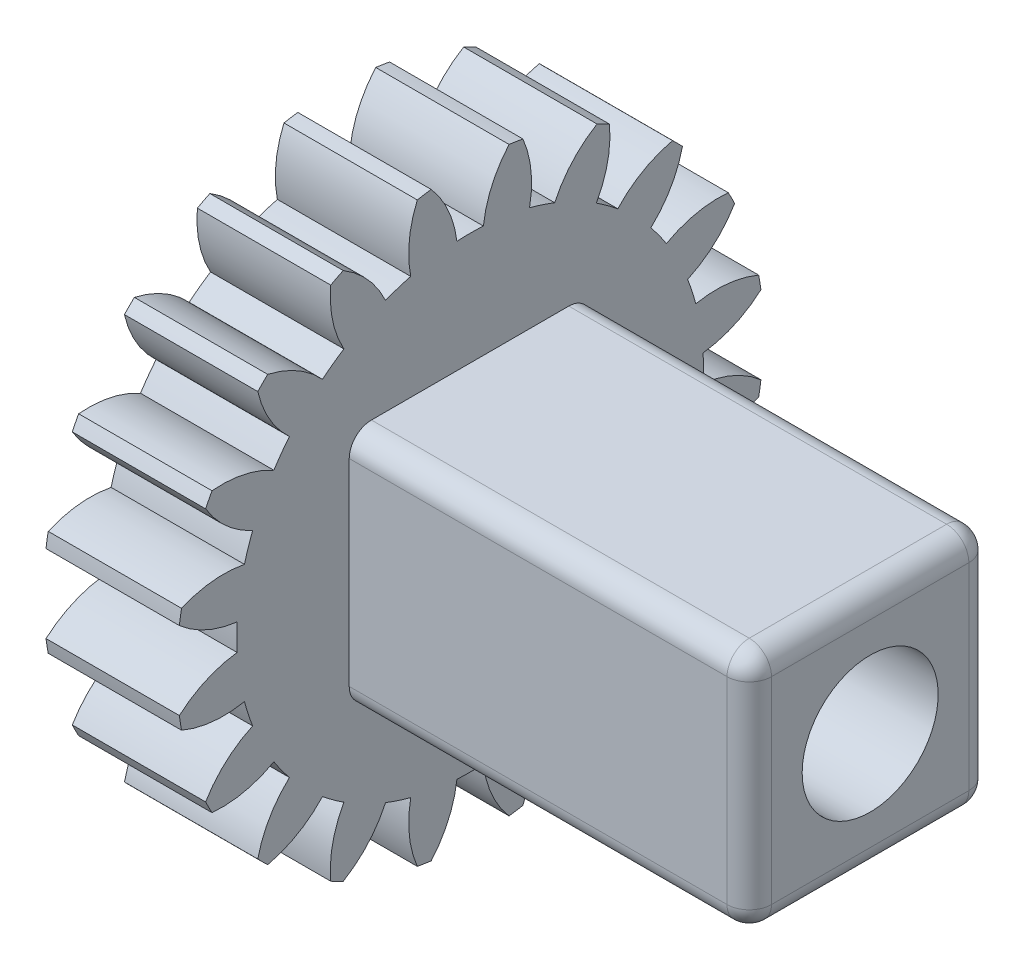
from build123d import *

# Parameters (mm, degrees)
BASPROSKE_W         = 15
BASPROSKE_H         = 33
TOOTHCUT_DEPTH      = 50.020403915
TEETHCUTS_COUNT     = 20
TEETHCUTS_ANGLE     = 342
BORSKE_R            = 2
BORE_DEPTH          = 50.0000508
SKETCH1_W           = 27.2
SKETCH1_H           = 27.2
BOSS_EXTRUDE1_DEPTH = 45
SKETCH2_R           = 7.65
CUT_EXTRUDE1_DEPTH  = 60
FILLET2_R           = 2.5


with BuildPart() as part:
    # BasProSke → Base-Revolve (revolve)
    with BuildSketch(Plane(origin=(0, 0, 0), x_dir=(1, 0, 0), z_dir=(0, 1, 0)), mode=Mode.PRIVATE) as base_revolve_sk:
        with Locations((7.5, 16.5)):
            Rectangle(BASPROSKE_W, BASPROSKE_H)
    revolve(base_revolve_sk.sketch.rotate(Axis((-10, 0, 0), (1, 0, 0)), 180), axis=Axis((-10, 0, 0), (1, 0, 0)))

    # TooCutSke → ToothCut (cut, through all)
    with BuildSketch(Plane(origin=(0, 0, 0), x_dir=(0, 0, -1), z_dir=(1, 0, 0))):
        with BuildLine():
            ThreePointArc((1.489278925, 26.206717637), (0, 26.249), (-1.489278925, 26.206717637))
            ThreePointArc((-1.489278925, 26.206717637), (-2.448651415, 29.690511169), (-4.401620335, 32.730762038))
            ThreePointArc((-4.401620335, 32.730762038), (0, 33.0254), (4.401620335, 32.730762038))
            ThreePointArc((4.401620335, 32.730762038), (2.448651415, 29.690511169), (1.489278925, 26.206717637))
        make_face()
    toothcut = extrude(amount=TOOTHCUT_DEPTH, mode=Mode.SUBTRACT)

    # TeethCuts: ToothCut ×20 about axis
    teethcuts_axis = Axis((-10, 0, 0), (1, 0, 0))
    for i in range(1, TEETHCUTS_COUNT):
        add(toothcut.rotate(teethcuts_axis, i * TEETHCUTS_ANGLE / (TEETHCUTS_COUNT - 1)), mode=Mode.SUBTRACT)

    # BorSke → Bore (cut, symmetric)
    with BuildSketch(Plane(origin=(0, 0, 0), x_dir=(0, 0, -1), z_dir=(1, 0, 0))):
        with Locations(Location((0, 0, 0), (0, 0, 180))):
            Circle(BORSKE_R)
    extrude(amount=BORE_DEPTH, both=True, mode=Mode.SUBTRACT)

    # Sketch1 → Boss-Extrude1 (add)
    with BuildSketch(Plane(origin=(15, 0, 0), x_dir=(0, 0, -1), z_dir=(1, 0, 0))):
        Rectangle(SKETCH1_W, SKETCH1_H)
    extrude(amount=BOSS_EXTRUDE1_DEPTH)

    # Sketch2 → Cut-Extrude1 (cut)
    with BuildSketch(Plane.ZY):
        Circle(SKETCH2_R)
    extrude(amount=-CUT_EXTRUDE1_DEPTH, mode=Mode.SUBTRACT)

    # Fillet2
    fillet2_edges = [part.edges().sort_by_distance(p)[0] for p in [
        (37.5, 13.6, 13.6),
        (37.5, -13.6, 13.6),
        (37.5, -13.6, -13.6),
        (37.5, 13.6, -13.6),
        (60, 0, 13.6),
        (60, -13.6, 0),
        (60, 0, -13.6),
        (60, 13.6, 0),
    ]]
    fillet(fillet2_edges, radius=FILLET2_R)


solid = part.part
